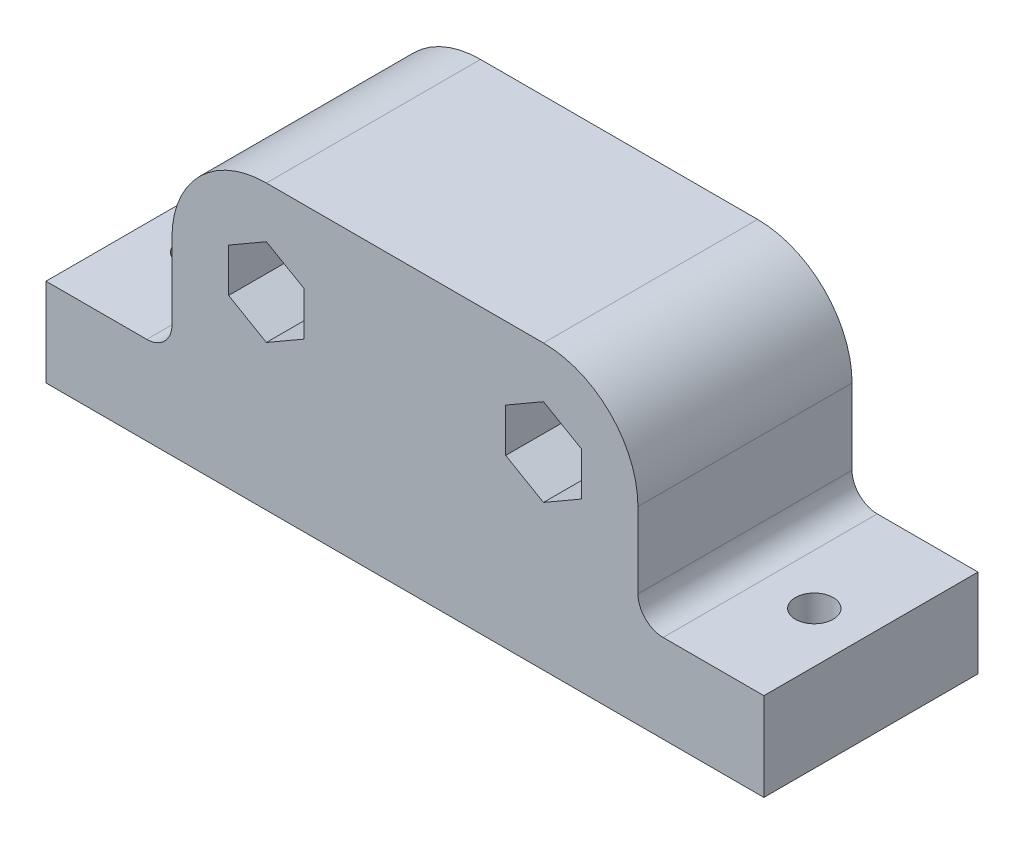
from build123d import *

# Parameters (mm, degrees)
EXTRUDE_1_DEPTH     = 15
FILLET_1_R          = 2
SKETCH_2_R          = 2.5
EXTRUDE_2_DEPTH     = 2
SKETCH_3_R          = 1.5
CUT_EXTRUDE_1_DEPTH = 46.005555213


with BuildPart() as part:
    # 草图1 → 凸台-拉伸1 (new body)
    with BuildSketch(Plane.XY):
        with BuildLine():
            Line((29.5, -8), (29.5, 0))
            ThreePointArc((29.5, 0), (27.303300859, 5.303300859), (22, 7.5))
            Line((22, 7.5), (0, 7.5))
            ThreePointArc((0, 7.5), (-5.303300859, 5.303300859), (-7.5, 0))
            Line((-7.5, 0), (-7.5, -8))
            Line((-7.5, -8), (-17.5, -8))
            Line((-17.5, -8), (-17.5, -15))
            Line((-17.5, -15), (39.5, -15))
            Line((39.5, -15), (39.5, -8))
            Line((39.5, -8), (29.5, -8))
        make_face()
        Polygon((25, -1.732050808), (22, -3.464101615), (19, -1.732050808), (19, 1.732050808), (22, 3.464101615), (25, 1.732050808), align=None, mode=Mode.SUBTRACT)
        Polygon((-3, 1.732050808), (0, 3.464101615), (3, 1.732050808), (3, -1.732050808), (0, -3.464101615), (-3, -1.732050808), align=None, mode=Mode.SUBTRACT)
    extrude(amount=EXTRUDE_1_DEPTH)

    # 圆角1
    fillet_1_edges = [part.edges().sort_by_distance(p)[0] for p in [
        (29.5, -8, 7.5),
        (-7.5, -8, 7.5),
    ]]
    fillet(fillet_1_edges, radius=FILLET_1_R)

    # 草图2 → 凸台-拉伸2 (add)
    with BuildSketch(Plane(origin=(0, 0, 0), x_dir=(-1, 0, 0), z_dir=(0, 0, -1))):
        with BuildLine():
            Line((-31.5, -8), (-39.5, -8))
            Line((-39.5, -8), (-39.5, -15))
            Line((-39.5, -15), (17.5, -15))
            Line((17.5, -15), (17.5, -8))
            Line((17.5, -8), (9.5, -8))
            ThreePointArc((9.5, -8), (8.085786438, -7.414213562), (7.5, -6))
            Line((7.5, -6), (7.5, 0))
            ThreePointArc((7.5, 0), (5.303300859, 5.303300859), (0, 7.5))
            Line((0, 7.5), (-22, 7.5))
            ThreePointArc((-22, 7.5), (-27.303300859, 5.303300859), (-29.5, 0))
            Line((-29.5, 0), (-29.5, -6))
            ThreePointArc((-29.5, -6), (-30.085786438, -7.414213562), (-31.5, -8))
        make_face()
        with Locations((-22, 0)):
            Circle(SKETCH_2_R, mode=Mode.SUBTRACT)
        Circle(SKETCH_2_R, mode=Mode.SUBTRACT)
    extrude(amount=EXTRUDE_2_DEPTH)

    # 草图3 → 切除-拉伸1 (cut, through all)
    with BuildSketch(Plane(origin=(0, -8, 0), x_dir=(1, 0, 0), z_dir=(0, 1, 0))):
        with Locations(Location((-13.5, -7, 0), (0, 0, 180))):
            Circle(SKETCH_3_R)
        with Locations(Location((35.5, -7, 0), (0, 0, 180))):
            Circle(SKETCH_3_R)
    extrude(amount=-CUT_EXTRUDE_1_DEPTH, mode=Mode.SUBTRACT)


solid = part.part
